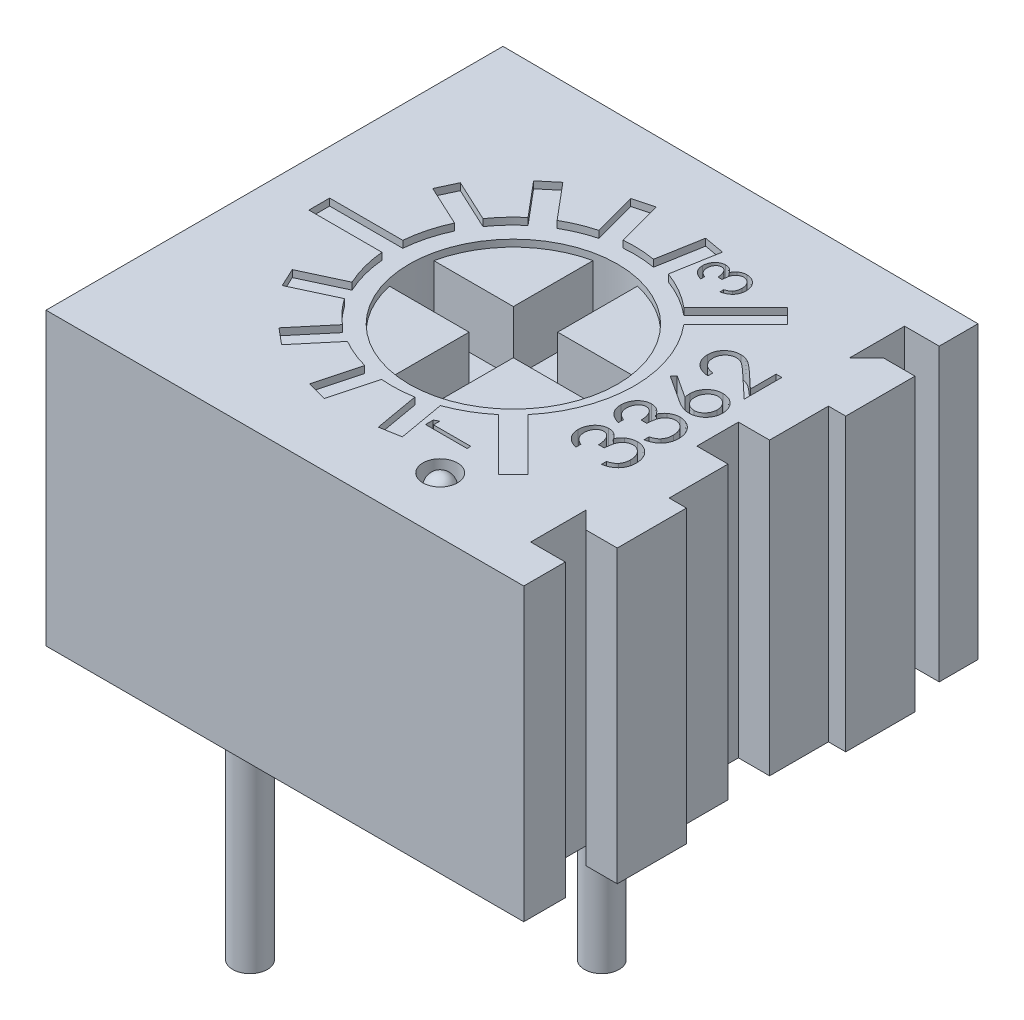
from build123d import *
from build123d.topology import SkipClean

# Parameters (mm, degrees)
BOSS_EXTRUDE1_DEPTH = 4.2
CUT_EXTRUDE3_DEPTH  = 0.2
CUT_EXTRUDE4_DEPTH  = 0.1
CUT_EXTRUDE5_DEPTH  = 0.5
CUT_EXTRUDE6_DEPTH  = 0.3
CUT_EXTRUDE7_DEPTH  = 0.89
SKETCH14_R          = 0.18
BOSS_EXTRUDE2_DEPTH = 0.32
REVOLVE1_ANGLE      = 180
BOSS_EXTRUDE3_DEPTH = 3.24


with BuildPart() as part:
    # Sketch3 → Boss-Extrude1 (new body)
    with BuildSketch(Plane(origin=(0, 0, 0), x_dir=(1, 0, 0), z_dir=(0, 1, 0))):
        Polygon((3.1, -1.938039121), (3.55, -1.938039121), (3.55, -0.938039121), (3.3, -0.938039121), (3.3, -0.088039121), (2.85, -0.088039121), (2.85, 0.511960879), (3.3, 0.511960879), (3.3, 1.361960879), (3.55, 1.361960879), (3.55, 2.361960879), (3.1, 2.361960879), (2.85, 2.111960879), (2.85, 2.911960879), (3.35, 2.911960879), (3.35, 3.472174064), (-3.55, 3.511960879), (-3.55, -3.088039121), (3.35, -3.088039121), (3.35, -2.488039121), (2.85, -2.488039121), (2.85, -1.688039121), align=None)
    extrude(amount=BOSS_EXTRUDE1_DEPTH)

    # Sketch5 → Cut-Extrude3 (cut)
    with BuildSketch(Plane(origin=(0, 4.2, 0), x_dir=(1, 0, 0), z_dir=(0, 1, 0))):
        with BuildLine():
            ThreePointArc((-1.60378018, 0.211962343), (-0.1, -1.291817837), (1.40378018, 0.211962343))
            ThreePointArc((1.40378018, 0.211962343), (-0.1, 1.715742524), (-1.60378018, 0.211962343))
        make_face()
    extrude(amount=-CUT_EXTRUDE3_DEPTH, mode=Mode.SUBTRACT)

    # Sketch5<5> → Cut-Extrude4 (cut)
    with BuildSketch(Plane(origin=(0, 4.2, 0), x_dir=(1, 0, 0), z_dir=(0, 1, 0))):
        with BuildLine():
            Line((-0.435140366, -2.183914718), (-0.260203012, -1.531039623))
            ThreePointArc((-0.260203012, -1.531039623), (-0.029388376, -1.536466305), (0.200131905, -1.511460589))
            Line((0.200131905, -1.511460589), (0.31300322, -2.151585629))
            Line((0.31300322, -2.151585629), (0.608445546, -2.099491175))
            Line((0.608445546, -2.099491175), (0.491075695, -1.433853672))
            ThreePointArc((0.491075695, -1.433853672), (0.770636357, -1.303944211), (1.023064377, -1.126995839))
            Line((1.023064377, -1.126995839), (1.770080564, -1.874012026))
            Line((1.770080564, -1.874012026), (1.982212598, -1.661879991))
            Line((1.982212598, -1.661879991), (1.235196412, -0.914863805))
            ThreePointArc((1.235196412, -0.914863805), (1.540276248, -0.387771779), (1.646247594, 0.211952979))
            ThreePointArc((1.646247594, 0.211952979), (1.540276248, 0.811677736), (1.235196412, 1.338769762))
            Line((1.235196412, 1.338769762), (1.982212598, 2.085785949))
            Line((1.982212598, 2.085785949), (1.770080564, 2.297917983))
            Line((1.770080564, 2.297917983), (1.023064377, 1.550901796))
            ThreePointArc((1.023064377, 1.550901796), (0.770636357, 1.727850169), (0.491075695, 1.857759629))
            Line((0.491075695, 1.857759629), (0.608445546, 2.523397133))
            Line((0.608445546, 2.523397133), (0.31300322, 2.575491586))
            Line((0.31300322, 2.575491586), (0.200131905, 1.935366546))
            ThreePointArc((0.200131905, 1.935366546), (-0.029388376, 1.960372262), (-0.260203012, 1.95494558))
            Line((-0.260203012, 1.95494558), (-0.435140366, 2.607820675))
            Line((-0.435140366, 2.607820675), (-0.724918114, 2.530174962))
            Line((-0.724918114, 2.530174962), (-0.556685735, 1.902323175))
            ThreePointArc((-0.556685735, 1.902323175), (-0.775269625, 1.827986588), (-0.982165312, 1.725521863))
            Line((-0.982165312, 1.725521863), (-1.416629336, 2.243295925))
            Line((-1.416629336, 2.243295925), (-1.646442669, 2.050459642))
            Line((-1.646442669, 2.050459642), (-1.228630723, 1.552530754))
            ThreePointArc((-1.228630723, 1.552530754), (-1.395319005, 1.392781383), (-1.539526714, 1.212478909))
            Line((-1.539526714, 1.212478909), (-2.152105616, 1.498129143))
            Line((-2.152105616, 1.498129143), (-2.278891095, 1.226236807))
            Line((-2.278891095, 1.226236807), (-1.689791033, 0.951534937))
            ThreePointArc((-1.689791033, 0.951534937), (-1.794449828, 0.663663314), (-1.847311983, 0.361952979))
            Line((-1.847311983, 0.361952979), (-2.903752406, 0.361952979))
            Line((-2.903752406, 0.361952979), (-2.903752406, 0.061952979))
            Line((-2.903752406, 0.061952979), (-1.847311983, 0.061952979))
            ThreePointArc((-1.847311983, 0.061952979), (-1.794449828, -0.239757357), (-1.689791033, -0.527628979))
            Line((-1.689791033, -0.527628979), (-2.278891095, -0.80233085))
            Line((-2.278891095, -0.80233085), (-2.152105616, -1.074223186))
            Line((-2.152105616, -1.074223186), (-1.539526714, -0.788572952))
            ThreePointArc((-1.539526714, -0.788572952), (-1.395319005, -0.968875425), (-1.228630723, -1.128624797))
            Line((-1.228630723, -1.128624797), (-1.646442669, -1.626553685))
            Line((-1.646442669, -1.626553685), (-1.416629336, -1.819389968))
            Line((-1.416629336, -1.819389968), (-0.982165312, -1.301615906))
            ThreePointArc((-0.982165312, -1.301615906), (-0.775269625, -1.40408063), (-0.556685735, -1.478417217))
            Line((-0.556685735, -1.478417217), (-0.724918114, -2.106269004))
            Line((-0.724918114, -2.106269004), (-0.435140366, -2.183914718))
        make_face()
    extrude(amount=-CUT_EXTRUDE4_DEPTH, mode=Mode.SUBTRACT)

    # Sketch5<6> → Cut-Extrude5 (cut)
    with BuildSketch(Plane(origin=(0, 4.2, 0), x_dir=(1, 0, 0), z_dir=(0, 1, 0))):
        with BuildLine():
            ThreePointArc((1.081757206, -2.276694537), (1.331757206, -2.526694537), (1.581757206, -2.276694537))
            ThreePointArc((1.581757206, -2.276694537), (1.331757206, -2.026694537), (1.081757206, -2.276694537))
        make_face()
    extrude(amount=-CUT_EXTRUDE5_DEPTH, mode=Mode.SUBTRACT)

    # Sketch10 → Cut-Extrude6 (cut)
    # profile 1 of 6: a face of its own
    with BuildSketch(Plane(origin=(0, 4.2, 0), x_dir=(1, 0, 0), z_dir=(0, 1, 0))):
        Polygon((0.620519629, -1.666924235), (0.620519629, -1.777861735), (1.220519629, -1.777861735), (1.220519629, -1.724015581), (0.682058091, -1.724015581), (0.682058091, -1.631707889), align=None)
    # profile 2 of 6: a face of its own
    with BuildSketch(Plane(origin=(0, 4.2, 0), x_dir=(1, 0, 0), z_dir=(0, 1, 0))):
        with BuildLine():
            Line((0.78751456, 2.085640337), (0.78751456, 2.031794183))
            add(Edge.make_bspline(
                [(0.78751456, 2.031794183), (0.781474706, 2.033252963), (0.769667285, 2.036104759), (0.752797468, 2.042052915), (0.736833436, 2.048532787), (0.722074109, 2.056313776), (0.708222869, 2.064800991), (0.695593876, 2.074524886), (0.683865939, 2.085036839), (0.673457956, 2.096663973), (0.664033202, 2.108857458), (0.655997478, 2.121789107), (0.649084766, 2.135198746), (0.643389869, 2.149179283), (0.639099779, 2.163772341), (0.635987184, 2.178845991), (0.63396585, 2.194439734), (0.633768576, 2.205025035), (0.633668406, 2.210399953)],
                knots=[0, 0, 0, 0, 1.162005537, 2.271625781, 3.343758855, 4.383309926, 5.390229558, 6.379919256, 7.361854164, 8.333198761, 9.295911338, 10.242430842, 11.177959212, 12.116337295, 13.062827104, 14.020064771, 14.994644689, 16, 16, 16, 16], degree=3))
            add(Edge.make_bspline(
                [(0.633668406, 2.210399953), (0.633904846, 2.21823128), (0.634372567, 2.23372311), (0.638643614, 2.25648249), (0.645402208, 2.278429944), (0.654740561, 2.299325244), (0.666258386, 2.318734118), (0.679966627, 2.336003179), (0.695600793, 2.350898352), (0.712869232, 2.363394531), (0.731324462, 2.373178817), (0.750318775, 2.380393623), (0.769807113, 2.384785912), (0.782965504, 2.38535515), (0.78955783, 2.385640337)],
                knots=[0, 0, 0, 0, 1.083050992, 2.142477498, 3.193116406, 4.255571735, 5.30263384, 6.308962982, 7.297363603, 8.282367274, 9.249857812, 10.179914175, 11.08814088, 12, 12, 12, 12], degree=3))
            add(Edge.make_bspline(
                [(0.78955783, 2.385640337), (0.795901851, 2.385440864), (0.808316118, 2.385050527), (0.826439803, 2.381736178), (0.84352122, 2.376158533), (0.859632277, 2.368432288), (0.874670821, 2.358430879), (0.888670688, 2.346315559), (0.901693972, 2.332000817), (0.909154453, 2.321153), (0.91299533, 2.315568222)],
                knots=[0, 0, 0, 0, 1.024540389, 2.004866551, 2.965041327, 3.920577974, 4.882998113, 5.874504559, 6.905732034, 8, 8, 8, 8], degree=3))
            add(Edge.make_bspline(
                [(0.91299533, 2.315568222), (0.916066129, 2.321958944), (0.922160131, 2.334641333), (0.934301296, 2.351753576), (0.947975261, 2.367524746), (0.958765378, 2.376216651), (0.964197253, 2.38059226)],
                knots=[0, 0, 0, 0, 1.015663554, 2.015584519, 3.001021554, 4, 4, 4, 4], degree=3))
            add(Edge.make_bspline(
                [(0.964197253, 2.38059226), (0.96815001, 2.383479347), (0.975990796, 2.389206244), (0.98859704, 2.396275193), (1.00134301, 2.402688184), (1.014570336, 2.407685364), (1.02812571, 2.41155517), (1.042032407, 2.414321347), (1.056301782, 2.416039771), (1.06595535, 2.416285866), (1.07080783, 2.416409568)],
                knots=[0, 0, 0, 0, 1.025084078, 2.033381695, 3.024893161, 4.013698104, 4.991890475, 5.976764909, 6.982997093, 8, 8, 8, 8], degree=3))
            add(Edge.make_bspline(
                [(1.07080783, 2.416409568), (1.079209453, 2.416101893), (1.095973162, 2.41548799), (1.120740901, 2.410002242), (1.144948476, 2.401494523), (1.16811386, 2.389426201), (1.189767372, 2.374651777), (1.209284535, 2.357269018), (1.225797722, 2.337029416), (1.239762082, 2.314666489), (1.250820747, 2.290334097), (1.258791431, 2.264414964), (1.263572241, 2.237059086), (1.264145887, 2.218351768), (1.264437637, 2.208837453)],
                knots=[0, 0, 0, 0, 0.955697303, 1.906897079, 2.875188111, 3.870982192, 4.871999088, 5.854111427, 6.836107184, 7.836239895, 8.848948182, 9.870701427, 10.917064451, 12, 12, 12, 12], degree=3))
            add(Edge.make_bspline(
                [(1.264437637, 2.208837453), (1.264287502, 2.202423119), (1.263992087, 2.18980185), (1.26200853, 2.171240071), (1.25828723, 2.153559531), (1.253607181, 2.136588544), (1.247136489, 2.120583245), (1.239422225, 2.105313411), (1.230266568, 2.090845977), (1.219654119, 2.077266858), (1.20777507, 2.064590563), (1.194432076, 2.053140042), (1.179874164, 2.042788607), (1.163970382, 2.033602029), (1.146765276, 2.025541646), (1.128189901, 2.018780918), (1.108388261, 2.012877967), (1.094592692, 2.010128128), (1.08751456, 2.00871726)],
                knots=[0, 0, 0, 0, 1.048603596, 2.063302207, 3.045874044, 3.999447474, 4.937100059, 5.862643889, 6.7929026, 7.7308982, 8.676022965, 9.627908155, 10.600123445, 11.591992905, 12.626222643, 13.701663232, 14.820785756, 16, 16, 16, 16], degree=3))
            Line((1.08751456, 2.00871726), (1.08751456, 2.062563414))
            add(Edge.make_bspline(
                [(1.08751456, 2.062563414), (1.092134391, 2.063966264), (1.101120363, 2.066694929), (1.114052987, 2.071339666), (1.125908654, 2.07663137), (1.136774332, 2.082308151), (1.146757029, 2.08827017), (1.155592778, 2.0949413), (1.16366967, 2.10182744), (1.168220175, 2.107018186), (1.170447253, 2.109558606)],
                knots=[0, 0, 0, 0, 1.198163088, 2.33053128, 3.407730985, 4.417276592, 5.372219308, 6.28897303, 7.162600585, 8, 8, 8, 8], degree=3))
            add(Edge.make_bspline(
                [(1.170447253, 2.109558606), (1.173036185, 2.112918395), (1.178206058, 2.1196276), (1.184822365, 2.130553666), (1.190485766, 2.142084743), (1.195089216, 2.154316994), (1.198544731, 2.167252058), (1.201031848, 2.180837467), (1.202673732, 2.19509551), (1.202822932, 2.204826345), (1.202899176, 2.209798991)],
                knots=[0, 0, 0, 0, 0.946083416, 1.889246487, 2.84504177, 3.809995578, 4.801312957, 5.829064617, 6.89060985, 8, 8, 8, 8], degree=3))
            add(Edge.make_bspline(
                [(1.202899176, 2.209798991), (1.202793592, 2.215413877), (1.202587132, 2.226393302), (1.200688439, 2.242414135), (1.197923226, 2.257655412), (1.193652429, 2.271947914), (1.188375711, 2.285478858), (1.18175027, 2.298058569), (1.173976889, 2.309852187), (1.165141605, 2.320708657), (1.155469349, 2.330470744), (1.145352822, 2.339066089), (1.13483468, 2.346373174), (1.123856717, 2.352267501), (1.112464392, 2.356921882), (1.100625735, 2.36009043), (1.088437632, 2.362293547), (1.080152666, 2.362472966), (1.075976099, 2.362563414)],
                knots=[0, 0, 0, 0, 1.217147791, 2.380027433, 3.494444702, 4.572153297, 5.609568379, 6.639424714, 7.649109417, 8.668170816, 9.669597737, 10.625200337, 11.543417969, 12.441394052, 13.322311151, 14.205496177, 15.095365482, 16, 16, 16, 16], degree=3))
            add(Edge.make_bspline(
                [(1.075976099, 2.362563414), (1.070385941, 2.362300525), (1.059233442, 2.361776054), (1.042819359, 2.357788566), (1.026998802, 2.351170672), (1.011976674, 2.342087487), (0.99822378, 2.330760067), (0.985865181, 2.317723959), (0.975677157, 2.302624514), (0.968631668, 2.288737625), (0.963825561, 2.276434704), (0.96062408, 2.265906429), (0.957913186, 2.254119559), (0.955391077, 2.241216764), (0.953244561, 2.227100781), (0.951454535, 2.211786993), (0.950022243, 2.195272291), (0.949382626, 2.183839519), (0.949053022, 2.177948029)],
                knots=[0, 0, 0, 0, 1.070505987, 2.135685285, 3.216438728, 4.346150463, 5.486482244, 6.621737109, 7.7759408, 8.963942283, 9.59839197, 10.305095457, 11.070459627, 11.915156775, 12.823989992, 13.805807174, 14.869297358, 16, 16, 16, 16], degree=3))
            Line((0.949053022, 2.177948029), (0.88751456, 2.177948029))
            add(Edge.make_bspline(
                [(0.88751456, 2.177948029), (0.887370437, 2.185368404), (0.887088235, 2.199898012), (0.884359964, 2.221178252), (0.879980016, 2.241440875), (0.873721827, 2.260394602), (0.866350435, 2.277636886), (0.857832996, 2.292656041), (0.848192631, 2.30505668), (0.837613915, 2.314968358), (0.826329779, 2.322501929), (0.814496731, 2.327919856), (0.802067862, 2.331148945), (0.793582549, 2.331578346), (0.789317445, 2.331794183)],
                knots=[0, 0, 0, 0, 1.322091412, 2.58874672, 3.817242262, 5.011895168, 6.140903042, 7.155122731, 8.080855046, 8.929742606, 9.727943956, 10.488587771, 11.240295418, 12, 12, 12, 12], degree=3))
            add(Edge.make_bspline(
                [(0.789317445, 2.331794183), (0.786183596, 2.331724696), (0.779948952, 2.331586455), (0.770811699, 2.329773762), (0.761954172, 2.327175074), (0.753477364, 2.323402093), (0.745363924, 2.318513611), (0.737524849, 2.312617142), (0.73006143, 2.305544634), (0.722935163, 2.297623348), (0.716452233, 2.2888519), (0.710778596, 2.279434897), (0.705965601, 2.269410526), (0.701983565, 2.258842998), (0.698991443, 2.247683069), (0.69684219, 2.235987282), (0.695498662, 2.223732196), (0.695305209, 2.215371336), (0.695206868, 2.211121106)],
                knots=[0, 0, 0, 0, 0.884325644, 1.759323928, 2.622595547, 3.489424008, 4.37295195, 5.294616785, 6.255907374, 7.274251867, 8.302369084, 9.333474657, 10.37669385, 11.44084034, 12.520297356, 13.637342342, 14.798947025, 16, 16, 16, 16], degree=3))
            add(Edge.make_bspline(
                [(0.695206868, 2.211121106), (0.695445387, 2.204289392), (0.695911271, 2.190945464), (0.699991787, 2.171708622), (0.706502316, 2.153825307), (0.714273691, 2.140155821), (0.721945194, 2.130061666), (0.728645031, 2.122848477), (0.736090658, 2.11576496), (0.744740665, 2.10927713), (0.754009258, 2.102715877), (0.764367603, 2.096742524), (0.775545499, 2.090938005), (0.783447608, 2.087440425), (0.78751456, 2.085640337)],
                knots=[0, 0, 0, 0, 1.472543308, 2.876219568, 4.221790263, 5.565193594, 6.249813518, 6.953379497, 7.687249741, 8.463570142, 9.283606569, 10.136032583, 11.040678096, 12, 12, 12, 12], degree=3))
        make_face()
    # profile 3 of 6: a face of its own
    with BuildSketch(Plane(origin=(0, 4.2, 0), x_dir=(1, 0, 0), z_dir=(0, 1, 0))):
        with BuildLine():
            Line((2.0510798, 0.942912174), (2.0510798, 0.871117302))
            add(Edge.make_bspline(
                [(2.0510798, 0.871117302), (2.041555026, 0.871585223), (2.022848622, 0.872504207), (1.995574587, 0.876807816), (1.969504918, 0.88296573), (1.944848938, 0.891672348), (1.921388639, 0.902485212), (1.899217207, 0.915452075), (1.878419221, 0.93081067), (1.859187485, 0.948229352), (1.841544612, 0.967147898), (1.826309128, 0.987560684), (1.813436517, 1.009010976), (1.802675091, 1.031433696), (1.794597412, 1.055081824), (1.788603894, 1.079740763), (1.784997872, 1.105518852), (1.784610264, 1.123082285), (1.784413133, 1.132014738)],
                knots=[0, 0, 0, 0, 1.10065271, 2.161652631, 3.183658789, 4.190468796, 5.17591951, 6.163126047, 7.15150782, 8.156236427, 9.156009102, 10.134482811, 11.092018607, 12.041330605, 13.001268258, 13.972401359, 14.968799086, 16, 16, 16, 16], degree=3))
            add(Edge.make_bspline(
                [(1.784413133, 1.132014738), (1.784616828, 1.140787487), (1.785017082, 1.158025624), (1.788506035, 1.183173923), (1.793852546, 1.207171431), (1.801775232, 1.229746186), (1.811716471, 1.251129866), (1.824079703, 1.271057708), (1.838279943, 1.290011587), (1.855029822, 1.30706128), (1.872901985, 1.322723479), (1.891989305, 1.336223348), (1.911726182, 1.347849541), (1.932266789, 1.357365218), (1.953678017, 1.364578523), (1.975754589, 1.369922891), (1.998751282, 1.372978021), (2.014318943, 1.37344433), (2.022233646, 1.373681405)],
                knots=[0, 0, 0, 0, 1.111674182, 2.184400057, 3.212814286, 4.223731311, 5.211378316, 6.196328225, 7.191884489, 8.207283132, 9.220262353, 10.201199469, 11.166417575, 12.120932471, 13.06540007, 14.026332106, 14.996573967, 16, 16, 16, 16], degree=3))
            add(Edge.make_bspline(
                [(2.022233646, 1.373681405), (2.033376004, 1.373294367), (2.055465186, 1.372527084), (2.087925796, 1.365963887), (2.119375453, 1.355712916), (2.144687699, 1.343371757), (2.165081995, 1.330918465), (2.181881942, 1.319707464), (2.199966207, 1.306508495), (2.219407987, 1.291434323), (2.239952676, 1.274225349), (2.26201944, 1.25532866), (2.285200249, 1.234256244), (2.301043369, 1.219479413), (2.309252877, 1.21182243)],
                knots=[0, 0, 0, 0, 1.184416499, 2.348048165, 3.509039915, 4.696071444, 5.333504901, 6.05069495, 6.844171097, 7.714965912, 8.667477798, 9.695072654, 10.805644396, 12, 12, 12, 12], degree=3))
            Line((2.309252877, 1.21182243), (2.522874672, 1.011662174))
            Line((2.522874672, 1.011662174), (2.522874672, 1.383937815))
            Line((2.522874672, 1.383937815), (2.604925954, 1.383937815))
            Line((2.604925954, 1.383937815), (2.604925954, 0.840348071))
            Line((2.604925954, 0.840348071), (2.27383621, 1.150604482))
            add(Edge.make_bspline(
                [(2.27383621, 1.150604482), (2.265950883, 1.158158284), (2.250804783, 1.172667593), (2.228692107, 1.193189325), (2.208177926, 1.211621094), (2.189301001, 1.228082212), (2.171785214, 1.242215585), (2.156197853, 1.254757809), (2.141853978, 1.264807087), (2.125227552, 1.275713463), (2.104927594, 1.286276659), (2.080119894, 1.295353769), (2.054582236, 1.300888592), (2.037324628, 1.301552554), (2.028643903, 1.301886533)],
                knots=[0, 0, 0, 0, 1.329631726, 2.553950428, 3.673215718, 4.687767853, 5.603093632, 6.413772471, 7.123043292, 7.734684054, 8.834405432, 9.900288307, 10.943827018, 12, 12, 12, 12], degree=3))
            add(Edge.make_bspline(
                [(2.028643903, 1.301886533), (2.023185297, 1.30174122), (2.012427434, 1.301454837), (1.996654689, 1.298927364), (1.981439875, 1.295107819), (1.96673619, 1.289634617), (1.95269147, 1.28241022), (1.939288617, 1.273616304), (1.92633114, 1.263470004), (1.914181814, 1.251732571), (1.903054682, 1.238838509), (1.893197748, 1.225216967), (1.884960237, 1.210805514), (1.878207437, 1.195664915), (1.872910207, 1.179837379), (1.869239675, 1.163292294), (1.866935107, 1.146075376), (1.866623297, 1.134319149), (1.866464415, 1.128328841)],
                knots=[0, 0, 0, 0, 0.991446411, 1.95395049, 2.89581595, 3.838931463, 4.798493298, 5.75982156, 6.748411868, 7.785213223, 8.824556874, 9.840280684, 10.836137867, 11.835679398, 12.848801643, 13.863922112, 14.911575587, 16, 16, 16, 16], degree=3))
            add(Edge.make_bspline(
                [(1.866464415, 1.128328841), (1.866621402, 1.12207108), (1.866929699, 1.109781871), (1.869264891, 1.091776891), (1.872805044, 1.074482322), (1.878427578, 1.058156214), (1.885070882, 1.042445037), (1.893510484, 1.027684199), (1.903317489, 1.013628626), (1.914689111, 1.000509503), (1.927465951, 0.988527568), (1.94154691, 0.977851838), (1.956830617, 0.968585305), (1.973254345, 0.960489049), (1.990981612, 0.953917083), (2.009945464, 0.948894432), (2.030064691, 0.944920356), (2.043958417, 0.943592686), (2.0510798, 0.942912174)],
                knots=[0, 0, 0, 0, 1.030878251, 2.024474673, 2.987898669, 3.934362936, 4.864849709, 5.795128259, 6.730474222, 7.685293701, 8.650606017, 9.611896181, 10.591709709, 11.591680886, 12.625074257, 13.701333388, 14.821793024, 16, 16, 16, 16], degree=3))
        make_face()
    # profile 4 of 6: a face of its own
    with BuildSketch(Plane(origin=(0, 4.2, 0), x_dir=(1, 0, 0), z_dir=(0, 1, 0))):
        with BuildLine():
            Line((1.784413133, 0.594194225), (1.827842621, 0.649482687))
            Line((1.827842621, 0.649482687), (2.1510798, 0.438104482))
            add(Edge.make_bspline(
                [(2.1510798, 0.438104482), (2.148836632, 0.452177688), (2.144461079, 0.479629068), (2.143739263, 0.507415559), (2.143387492, 0.520957046)],
                knots=[0, 0, 0, 0, 1.025318673, 2, 2, 2, 2], degree=3))
            add(Edge.make_bspline(
                [(2.143387492, 0.520957046), (2.143606032, 0.529087902), (2.144036221, 0.545093251), (2.147346816, 0.568591948), (2.152563984, 0.591172277), (2.160169072, 0.612740643), (2.169883891, 0.633374479), (2.181527081, 0.653192124), (2.195699731, 0.671821328), (2.211532017, 0.689500931), (2.229066227, 0.70555532), (2.247676228, 0.719758016), (2.267360549, 0.731753379), (2.288114762, 0.741310151), (2.309776407, 0.748947705), (2.332429966, 0.754384713), (2.356113673, 0.757635039), (2.37222345, 0.758073874), (2.380406723, 0.758296789)],
                knots=[0, 0, 0, 0, 1.043709831, 2.054511743, 3.041122595, 4.01515914, 4.98481438, 5.965901842, 6.960491961, 7.985277438, 9.0096037, 10.00832444, 10.987059228, 11.962929573, 12.936966118, 13.931840027, 14.949438142, 16, 16, 16, 16], degree=3))
            add(Edge.make_bspline(
                [(2.380406723, 0.758296789), (2.391602503, 0.757972299), (2.413633148, 0.757333778), (2.445713267, 0.750944475), (2.476257117, 0.741090232), (2.504736177, 0.726779725), (2.531347695, 0.709341371), (2.554849568, 0.68781427), (2.575809493, 0.663266477), (2.59332912, 0.635495082), (2.6076389, 0.605611786), (2.617916534, 0.574216829), (2.62424422, 0.541616394), (2.625037496, 0.519489619), (2.625438774, 0.508296789)],
                knots=[0, 0, 0, 0, 1.031403119, 2.029557249, 3.004870281, 3.983165322, 4.960181699, 5.929903783, 6.912123683, 7.928973898, 8.949315281, 9.960468141, 10.968302741, 12, 12, 12, 12], degree=3))
            add(Edge.make_bspline(
                [(2.625438774, 0.508296789), (2.625090463, 0.497531376), (2.624400519, 0.476206977), (2.618222358, 0.444846108), (2.608279836, 0.414658773), (2.594295017, 0.386032469), (2.576928799, 0.359470509), (2.556167896, 0.335516962), (2.531983467, 0.314813802), (2.50490456, 0.297429378), (2.475846967, 0.283582688), (2.445495929, 0.273295876), (2.413978866, 0.267255419), (2.392611353, 0.266413269), (2.381849031, 0.265989097)],
                knots=[0, 0, 0, 0, 1.012172929, 2.004937354, 2.995255351, 3.995689452, 4.993936421, 5.973737378, 6.968231049, 7.979117505, 8.993136101, 9.989812463, 10.987515067, 12, 12, 12, 12], degree=3))
            add(Edge.make_bspline(
                [(2.381849031, 0.265989097), (2.373610269, 0.266259142), (2.356788291, 0.266810521), (2.331310799, 0.270660439), (2.305241981, 0.276846678), (2.283126736, 0.283774734), (2.265009817, 0.291094873), (2.250403305, 0.297186882), (2.235372202, 0.30476951), (2.219401086, 0.312854854), (2.202901558, 0.32217071), (2.185597862, 0.332300001), (2.167765193, 0.343522779), (2.155663663, 0.351390244), (2.149477236, 0.355412174)],
                knots=[0, 0, 0, 0, 1.173818275, 2.396712641, 3.66331629, 4.989737886, 5.693666774, 6.447286557, 7.243889047, 8.091586357, 8.998013824, 9.943181721, 10.948533338, 12, 12, 12, 12], degree=3))
            Line((2.149477236, 0.355412174), (1.784413133, 0.594194225))
        make_face()
        with BuildLine():
            add(Edge.make_bspline(
                [(2.225438774, 0.505892943), (2.225614896, 0.499798122), (2.225958913, 0.487893166), (2.228000129, 0.470436919), (2.231715374, 0.453862118), (2.236866886, 0.438163952), (2.243218096, 0.423245579), (2.251367258, 0.409402641), (2.260859171, 0.396350281), (2.271676664, 0.384297042), (2.283512378, 0.37336619), (2.29619153, 0.363953527), (2.3094061, 0.355834078), (2.323267143, 0.349232531), (2.337769193, 0.344091939), (2.352845594, 0.340373483), (2.368597435, 0.338304054), (2.37927915, 0.337959772), (2.384733646, 0.337783969)],
                knots=[0, 0, 0, 0, 1.129656352, 2.206547016, 3.251334079, 4.271920891, 5.265058649, 6.249872215, 7.241923875, 8.251504132, 9.246416584, 10.222533834, 11.173322129, 12.116503788, 13.062124155, 14.020151864, 14.989013135, 16, 16, 16, 16], degree=3))
            add(Edge.make_bspline(
                [(2.384733646, 0.337783969), (2.390138411, 0.337932207), (2.400789164, 0.338224329), (2.416423382, 0.34071145), (2.431434163, 0.344686855), (2.445765093, 0.350429595), (2.45969129, 0.357408168), (2.472778028, 0.366365704), (2.485449215, 0.376646353), (2.497116104, 0.388649949), (2.507947169, 0.401630588), (2.517453451, 0.415469791), (2.525491998, 0.429959184), (2.532152822, 0.445057037), (2.537056139, 0.46094998), (2.540809895, 0.47737995), (2.542862124, 0.494570332), (2.543210071, 0.506208526), (2.543387492, 0.512142943)],
                knots=[0, 0, 0, 0, 0.989367052, 1.949669134, 2.891858276, 3.827522767, 4.772653562, 5.738670152, 6.725809442, 7.756636004, 8.798867547, 9.819240912, 10.826537776, 11.829883227, 12.835515726, 13.868058748, 14.912904531, 16, 16, 16, 16], degree=3))
            add(Edge.make_bspline(
                [(2.543387492, 0.512142943), (2.543210057, 0.51807735), (2.542862083, 0.529715526), (2.54081005, 0.546906046), (2.537055569, 0.563335505), (2.532154887, 0.579230304), (2.525484292, 0.594321273), (2.517503756, 0.608798), (2.507888882, 0.622506314), (2.497134701, 0.635495401), (2.485382548, 0.647449112), (2.472892202, 0.657971551), (2.459586576, 0.666649234), (2.445819851, 0.673904502), (2.431425603, 0.679583656), (2.416425718, 0.683578632), (2.400788555, 0.686060463), (2.390138206, 0.686353311), (2.384733646, 0.686501917)],
                knots=[0, 0, 0, 0, 1.087281468, 2.132306021, 3.165025708, 4.170830268, 5.174347389, 6.181816599, 7.194310624, 8.23672049, 9.267723423, 10.261267456, 11.222032883, 12.171822355, 13.107646935, 14.049997283, 15.01046367, 16, 16, 16, 16], degree=3))
            add(Edge.make_bspline(
                [(2.384733646, 0.686501917), (2.379272035, 0.686376136), (2.368552667, 0.686129269), (2.352852641, 0.683337052), (2.337692591, 0.67946451), (2.32316781, 0.673616957), (2.309335571, 0.666020043), (2.296126168, 0.656766651), (2.283437674, 0.646062227), (2.271653503, 0.633696439), (2.260870898, 0.62023823), (2.251380312, 0.605917246), (2.243279109, 0.590994622), (2.236886618, 0.57526015), (2.231736754, 0.558925537), (2.228013375, 0.541877989), (2.225964234, 0.524105383), (2.225616158, 0.512041081), (2.225438774, 0.505892943)],
                knots=[0, 0, 0, 0, 0.978259475, 1.920005202, 2.851759169, 3.7803069, 4.719124913, 5.675758531, 6.668034766, 7.691045932, 8.733780038, 9.756656648, 10.768121246, 11.773215211, 12.79725739, 13.836288844, 14.897342417, 16, 16, 16, 16], degree=3))
        make_face(mode=Mode.SUBTRACT)
    # profile 5 of 6: a face of its own
    with BuildSketch(Plane(origin=(0, 4.2, 0), x_dir=(1, 0, 0), z_dir=(0, 1, 0))):
        with BuildLine():
            Line((1.989541339, -0.287857057), (1.989541339, -0.359651929))
            add(Edge.make_bspline(
                [(1.989541339, -0.359651929), (1.981488199, -0.357706889), (1.965744971, -0.353904494), (1.943251883, -0.34597362), (1.921966506, -0.33733379), (1.902287404, -0.326959138), (1.883819083, -0.315642851), (1.866980426, -0.302677658), (1.851343177, -0.288661721), (1.837465865, -0.273158876), (1.824899527, -0.256900896), (1.814185229, -0.239658697), (1.804968279, -0.221779178), (1.797375083, -0.203138462), (1.791654964, -0.183681052), (1.787504837, -0.163582852), (1.784809725, -0.142791195), (1.784546693, -0.12867746), (1.784413133, -0.121510903)],
                knots=[0, 0, 0, 0, 1.162005537, 2.271625781, 3.343758855, 4.383309926, 5.390229558, 6.379919256, 7.361854164, 8.333198761, 9.295911338, 10.242430842, 11.177959212, 12.116337295, 13.062827104, 14.020064771, 14.994644689, 16, 16, 16, 16], degree=3))
            add(Edge.make_bspline(
                [(1.784413133, -0.121510903), (1.784728386, -0.111069133), (1.785352015, -0.090413359), (1.791046743, -0.06006752), (1.800058202, -0.030804247), (1.812509339, -0.002943848), (1.82786644, 0.022934651), (1.846144094, 0.045960065), (1.866989648, 0.065820296), (1.890014235, 0.082481868), (1.914621208, 0.095527582), (1.939946958, 0.105147325), (1.965931409, 0.111003709), (1.98347593, 0.111762694), (1.992265697, 0.112142943)],
                knots=[0, 0, 0, 0, 1.083050992, 2.142477498, 3.193116406, 4.255571735, 5.30263384, 6.308962982, 7.297363603, 8.282367274, 9.249857812, 10.179914175, 11.08814088, 12, 12, 12, 12], degree=3))
            add(Edge.make_bspline(
                [(1.992265697, 0.112142943), (2.000724393, 0.111876979), (2.017276749, 0.11135653), (2.041441662, 0.106937397), (2.064216885, 0.099500537), (2.085698294, 0.089198877), (2.105749686, 0.075863666), (2.124416175, 0.059709906), (2.141780554, 0.040623584), (2.151727862, 0.026159826), (2.156849031, 0.018713456)],
                knots=[0, 0, 0, 0, 1.024540389, 2.004866551, 2.965041327, 3.920577974, 4.882998113, 5.874504559, 6.905732034, 8, 8, 8, 8], degree=3))
            add(Edge.make_bspline(
                [(2.156849031, 0.018713456), (2.16094343, 0.027234419), (2.169068767, 0.04414427), (2.185256986, 0.066960596), (2.203488939, 0.087988821), (2.217875763, 0.099578028), (2.225118262, 0.105412174)],
                knots=[0, 0, 0, 0, 1.015663554, 2.015584519, 3.001021554, 4, 4, 4, 4], degree=3))
            add(Edge.make_bspline(
                [(2.225118262, 0.105412174), (2.230388605, 0.109261624), (2.240842986, 0.116897486), (2.257651312, 0.12632275), (2.274645938, 0.134873405), (2.292282373, 0.141536312), (2.310356205, 0.146696053), (2.328898467, 0.150384289), (2.347924301, 0.152675521), (2.360795725, 0.153003648), (2.367265697, 0.153168584)],
                knots=[0, 0, 0, 0, 1.025084078, 2.033381695, 3.024893161, 4.013698104, 4.991890475, 5.976764909, 6.982997093, 8, 8, 8, 8], degree=3))
            add(Edge.make_bspline(
                [(2.367265697, 0.153168584), (2.378467862, 0.152758351), (2.400819474, 0.151939814), (2.433843127, 0.144625484), (2.466119892, 0.133281857), (2.497007072, 0.117190762), (2.525878421, 0.09749153), (2.551901305, 0.074314518), (2.573918888, 0.047328381), (2.592538034, 0.017511145), (2.607282921, -0.014932044), (2.6179105, -0.049490888), (2.624284912, -0.085965392), (2.625049775, -0.110908482), (2.625438774, -0.123594236)],
                knots=[0, 0, 0, 0, 0.955697303, 1.906897079, 2.875188111, 3.870982192, 4.871999088, 5.854111427, 6.836107184, 7.836239895, 8.848948182, 9.870701427, 10.917064451, 12, 12, 12, 12], degree=3))
            add(Edge.make_bspline(
                [(2.625438774, -0.123594236), (2.625238595, -0.132146681), (2.624844708, -0.14897504), (2.622199964, -0.173724078), (2.617238232, -0.197298132), (2.610998166, -0.219926114), (2.602370577, -0.241266513), (2.592084892, -0.261626291), (2.579877348, -0.280916204), (2.565727417, -0.299021696), (2.549888685, -0.315923422), (2.532098026, -0.331190784), (2.512687477, -0.344992698), (2.491482435, -0.357241468), (2.468542293, -0.367988645), (2.443775126, -0.377002949), (2.417372939, -0.38487355), (2.398978848, -0.388540002), (2.389541339, -0.390421159)],
                knots=[0, 0, 0, 0, 1.048603596, 2.063302207, 3.045874044, 3.999447474, 4.937100059, 5.862643889, 6.7929026, 7.7308982, 8.676022965, 9.627908155, 10.600123445, 11.591992905, 12.626222643, 13.701663232, 14.820785756, 16, 16, 16, 16], degree=3))
            Line((2.389541339, -0.390421159), (2.389541339, -0.318626288))
            add(Edge.make_bspline(
                [(2.389541339, -0.318626288), (2.395701113, -0.316755821), (2.407682409, -0.313117601), (2.424925908, -0.306924619), (2.440733463, -0.299869014), (2.455221034, -0.292299972), (2.468531297, -0.284350612), (2.480312296, -0.275455772), (2.491081485, -0.266274254), (2.497148825, -0.259353259), (2.500118262, -0.255966031)],
                knots=[0, 0, 0, 0, 1.198163088, 2.33053128, 3.407730985, 4.417276592, 5.372219308, 6.28897303, 7.162600585, 8, 8, 8, 8], degree=3))
            add(Edge.make_bspline(
                [(2.500118262, -0.255966031), (2.503570171, -0.251486313), (2.510463335, -0.242540706), (2.519285078, -0.227972619), (2.526836279, -0.212597849), (2.532974212, -0.196288181), (2.537581566, -0.179041429), (2.540897722, -0.160927551), (2.543086901, -0.141916827), (2.543285834, -0.12894238), (2.543387492, -0.122312185)],
                knots=[0, 0, 0, 0, 0.946083416, 1.889246487, 2.84504177, 3.809995578, 4.801312957, 5.829064617, 6.89060985, 8, 8, 8, 8], degree=3))
            add(Edge.make_bspline(
                [(2.543387492, -0.122312185), (2.543246714, -0.11482567), (2.542971434, -0.100186437), (2.540439844, -0.078825326), (2.536752892, -0.058503624), (2.531058496, -0.039446955), (2.524022873, -0.021405696), (2.515188952, -0.004632748), (2.504824444, 0.011092077), (2.493044065, 0.025567369), (2.480147723, 0.038583485), (2.466659021, 0.050043946), (2.452634832, 0.059786725), (2.437997547, 0.067645829), (2.42280778, 0.073851669), (2.407022905, 0.078076401), (2.390772101, 0.08101389), (2.37972548, 0.081253115), (2.374156723, 0.081373712)],
                knots=[0, 0, 0, 0, 1.217147791, 2.380027433, 3.494444702, 4.572153297, 5.609568379, 6.639424714, 7.649109417, 8.668170816, 9.669597737, 10.625200337, 11.543417969, 12.441394052, 13.322311151, 14.205496177, 15.095365482, 16, 16, 16, 16], degree=3))
            add(Edge.make_bspline(
                [(2.374156723, 0.081373712), (2.36670318, 0.081023193), (2.35183318, 0.080323899), (2.329947737, 0.075007248), (2.308853661, 0.066183389), (2.288824157, 0.054072476), (2.270486965, 0.038969249), (2.254008833, 0.021587772), (2.240424801, 0.001455179), (2.231030816, -0.017060673), (2.224622673, -0.033464568), (2.220354032, -0.047502268), (2.216739506, -0.063218094), (2.213376693, -0.080421822), (2.210514673, -0.099243131), (2.208127972, -0.119661516), (2.206218248, -0.141681119), (2.205365427, -0.156924814), (2.204925954, -0.164780134)],
                knots=[0, 0, 0, 0, 1.070505987, 2.135685285, 3.216438728, 4.346150463, 5.486482244, 6.621737109, 7.7759408, 8.963942283, 9.59839197, 10.305095457, 11.070459627, 11.915156775, 12.823989992, 13.805807174, 14.869297358, 16, 16, 16, 16], degree=3))
            Line((2.204925954, -0.164780134), (2.122874672, -0.164780134))
            add(Edge.make_bspline(
                [(2.122874672, -0.164780134), (2.122682508, -0.154886301), (2.122306238, -0.13551349), (2.118668543, -0.107139838), (2.112828613, -0.080123006), (2.10448436, -0.05485137), (2.094655839, -0.031861658), (2.083299253, -0.011836119), (2.070445433, 0.004698067), (2.056340478, 0.017913637), (2.041294963, 0.027958399), (2.025517566, 0.035182301), (2.008945741, 0.039487753), (1.99763199, 0.040060289), (1.991945185, 0.040348071)],
                knots=[0, 0, 0, 0, 1.322091412, 2.58874672, 3.817242262, 5.011895168, 6.140903042, 7.155122731, 8.080855046, 8.929742606, 9.727943956, 10.488587771, 11.240295418, 12, 12, 12, 12], degree=3))
            add(Edge.make_bspline(
                [(1.991945185, 0.040348071), (1.987766719, 0.040255422), (1.97945386, 0.0400711), (1.967270856, 0.037654176), (1.955460821, 0.034189259), (1.94415841, 0.029158617), (1.93334049, 0.022640642), (1.92288839, 0.014778683), (1.912937165, 0.005348672), (1.903435476, -0.005213043), (1.894791569, -0.016908307), (1.88722672, -0.02946431), (1.880809392, -0.042830139), (1.875500011, -0.056920175), (1.871510515, -0.071800082), (1.868644844, -0.087394463), (1.866853474, -0.103734578), (1.866595537, -0.114882392), (1.866464415, -0.120549365)],
                knots=[0, 0, 0, 0, 0.884325644, 1.759323928, 2.622595547, 3.489424008, 4.37295195, 5.294616785, 6.255907374, 7.274251867, 8.302369084, 9.333474657, 10.37669385, 11.44084034, 12.520297356, 13.637342342, 14.798947025, 16, 16, 16, 16], degree=3))
            add(Edge.make_bspline(
                [(1.866464415, -0.120549365), (1.866782441, -0.129658317), (1.867403619, -0.14745022), (1.872844308, -0.173099344), (1.881525013, -0.196943764), (1.891886846, -0.215169744), (1.902115516, -0.228628619), (1.911048633, -0.238246204), (1.920976136, -0.247690893), (1.932509479, -0.256341333), (1.944867602, -0.26508967), (1.958678729, -0.273054142), (1.973582591, -0.2807935), (1.984118736, -0.28545694), (1.989541339, -0.287857057)],
                knots=[0, 0, 0, 0, 1.472543308, 2.876219568, 4.221790263, 5.565193594, 6.249813518, 6.953379497, 7.687249741, 8.463570142, 9.283606569, 10.136032583, 11.040678096, 12, 12, 12, 12], degree=3))
        make_face()
    # profile 6 of 6: a face of its own
    with BuildSketch(Plane(origin=(0, 4.2, 0), x_dir=(1, 0, 0), z_dir=(0, 1, 0))):
        with BuildLine():
            Line((1.989541339, -0.903241672), (1.989541339, -0.975036544))
            add(Edge.make_bspline(
                [(1.989541339, -0.975036544), (1.981488199, -0.973091504), (1.965744971, -0.96928911), (1.943251883, -0.961358236), (1.921966506, -0.952718406), (1.902287404, -0.942343753), (1.883819083, -0.931027467), (1.866980426, -0.918062273), (1.851343177, -0.904046337), (1.837465865, -0.888543491), (1.824899527, -0.872285511), (1.814185229, -0.855043312), (1.804968279, -0.837163794), (1.797375083, -0.818523078), (1.791654964, -0.799065667), (1.787504837, -0.778967467), (1.784809725, -0.75817581), (1.784546693, -0.744062075), (1.784413133, -0.736895518)],
                knots=[0, 0, 0, 0, 1.162005537, 2.271625781, 3.343758855, 4.383309926, 5.390229558, 6.379919256, 7.361854164, 8.333198761, 9.295911338, 10.242430842, 11.177959212, 12.116337295, 13.062827104, 14.020064771, 14.994644689, 16, 16, 16, 16], degree=3))
            add(Edge.make_bspline(
                [(1.784413133, -0.736895518), (1.784728386, -0.726453749), (1.785352015, -0.705797975), (1.791046743, -0.675452136), (1.800058202, -0.646188863), (1.812509339, -0.618328463), (1.82786644, -0.592449964), (1.846144094, -0.56942455), (1.866989648, -0.549564319), (1.890014235, -0.532902747), (1.914621208, -0.519857033), (1.939946958, -0.51023729), (1.965931409, -0.504380906), (1.98347593, -0.503621922), (1.992265697, -0.503241672)],
                knots=[0, 0, 0, 0, 1.083050992, 2.142477498, 3.193116406, 4.255571735, 5.30263384, 6.308962982, 7.297363603, 8.282367274, 9.249857812, 10.179914175, 11.08814088, 12, 12, 12, 12], degree=3))
            add(Edge.make_bspline(
                [(1.992265697, -0.503241672), (2.000724393, -0.503507636), (2.017276749, -0.504028086), (2.041441662, -0.508447218), (2.064216885, -0.515884078), (2.085698294, -0.526185738), (2.105749686, -0.53952095), (2.124416175, -0.555674709), (2.141780554, -0.574761032), (2.151727862, -0.589224789), (2.156849031, -0.596671159)],
                knots=[0, 0, 0, 0, 1.024540389, 2.004866551, 2.965041327, 3.920577974, 4.882998113, 5.874504559, 6.905732034, 8, 8, 8, 8], degree=3))
            add(Edge.make_bspline(
                [(2.156849031, -0.596671159), (2.16094343, -0.588150197), (2.169068767, -0.571240345), (2.185256986, -0.54842402), (2.203488939, -0.527395794), (2.217875763, -0.515806587), (2.225118262, -0.509972442)],
                knots=[0, 0, 0, 0, 1.015663554, 2.015584519, 3.001021554, 4, 4, 4, 4], degree=3))
            add(Edge.make_bspline(
                [(2.225118262, -0.509972442), (2.230388605, -0.506122992), (2.240842986, -0.49848713), (2.257651312, -0.489061865), (2.274645938, -0.48051121), (2.292282373, -0.473848303), (2.310356205, -0.468688562), (2.328898467, -0.465000326), (2.347924301, -0.462709094), (2.360795725, -0.462380968), (2.367265697, -0.462216031)],
                knots=[0, 0, 0, 0, 1.025084078, 2.033381695, 3.024893161, 4.013698104, 4.991890475, 5.976764909, 6.982997093, 8, 8, 8, 8], degree=3))
            add(Edge.make_bspline(
                [(2.367265697, -0.462216031), (2.378467862, -0.462626265), (2.400819474, -0.463444802), (2.433843127, -0.470759132), (2.466119892, -0.482102758), (2.497007072, -0.498193853), (2.525878421, -0.517893085), (2.551901305, -0.541070097), (2.573918888, -0.568056234), (2.592538034, -0.59787347), (2.607282921, -0.630316659), (2.6179105, -0.664875504), (2.624284912, -0.701350007), (2.625049775, -0.726293097), (2.625438774, -0.738978852)],
                knots=[0, 0, 0, 0, 0.955697303, 1.906897079, 2.875188111, 3.870982192, 4.871999088, 5.854111427, 6.836107184, 7.836239895, 8.848948182, 9.870701427, 10.917064451, 12, 12, 12, 12], degree=3))
            add(Edge.make_bspline(
                [(2.625438774, -0.738978852), (2.625238595, -0.747531296), (2.624844708, -0.764359655), (2.622199964, -0.789108694), (2.617238232, -0.812682747), (2.610998166, -0.835310729), (2.602370577, -0.856651128), (2.592084892, -0.877010906), (2.579877348, -0.89630082), (2.565727417, -0.914406311), (2.549888685, -0.931308038), (2.532098026, -0.946575399), (2.512687477, -0.960377313), (2.491482435, -0.972626083), (2.468542293, -0.98337326), (2.443775126, -0.992387564), (2.417372939, -1.000258165), (2.398978848, -1.003924618), (2.389541339, -1.005805775)],
                knots=[0, 0, 0, 0, 1.048603596, 2.063302207, 3.045874044, 3.999447474, 4.937100059, 5.862643889, 6.7929026, 7.7308982, 8.676022965, 9.627908155, 10.600123445, 11.591992905, 12.626222643, 13.701663232, 14.820785756, 16, 16, 16, 16], degree=3))
            Line((2.389541339, -1.005805775), (2.389541339, -0.934010903))
            add(Edge.make_bspline(
                [(2.389541339, -0.934010903), (2.395701113, -0.932140436), (2.407682409, -0.928502216), (2.424925908, -0.922309234), (2.440733463, -0.915253629), (2.455221034, -0.907684587), (2.468531297, -0.899735228), (2.480312296, -0.890840388), (2.491081485, -0.881658869), (2.497148825, -0.874737874), (2.500118262, -0.871350647)],
                knots=[0, 0, 0, 0, 1.198163088, 2.33053128, 3.407730985, 4.417276592, 5.372219308, 6.28897303, 7.162600585, 8, 8, 8, 8], degree=3))
            add(Edge.make_bspline(
                [(2.500118262, -0.871350647), (2.503570171, -0.866870929), (2.510463335, -0.857925321), (2.519285078, -0.843357234), (2.526836279, -0.827982464), (2.532974212, -0.811672797), (2.537581566, -0.794426044), (2.540897722, -0.776312166), (2.543086901, -0.757301442), (2.543285834, -0.744326995), (2.543387492, -0.7376968)],
                knots=[0, 0, 0, 0, 0.946083416, 1.889246487, 2.84504177, 3.809995578, 4.801312957, 5.829064617, 6.89060985, 8, 8, 8, 8], degree=3))
            add(Edge.make_bspline(
                [(2.543387492, -0.7376968), (2.543246714, -0.730210286), (2.542971434, -0.715571052), (2.540439844, -0.694209941), (2.536752892, -0.673888239), (2.531058496, -0.65483157), (2.524022873, -0.636790311), (2.515188952, -0.620017363), (2.504824444, -0.604292539), (2.493044065, -0.589817246), (2.480147723, -0.57680113), (2.466659021, -0.56534067), (2.452634832, -0.55559789), (2.437997547, -0.547738786), (2.42280778, -0.541532946), (2.407022905, -0.537308215), (2.390772101, -0.534370726), (2.37972548, -0.5341315), (2.374156723, -0.534010903)],
                knots=[0, 0, 0, 0, 1.217147791, 2.380027433, 3.494444702, 4.572153297, 5.609568379, 6.639424714, 7.649109417, 8.668170816, 9.669597737, 10.625200337, 11.543417969, 12.441394052, 13.322311151, 14.205496177, 15.095365482, 16, 16, 16, 16], degree=3))
            add(Edge.make_bspline(
                [(2.374156723, -0.534010903), (2.36670318, -0.534361422), (2.35183318, -0.535060717), (2.329947737, -0.540377367), (2.308853661, -0.549201226), (2.288824157, -0.561312139), (2.270486965, -0.576415366), (2.254008833, -0.593796843), (2.240424801, -0.613929436), (2.231030816, -0.632445288), (2.224622673, -0.648849183), (2.220354032, -0.662886884), (2.216739506, -0.67860271), (2.213376693, -0.695806437), (2.210514673, -0.714627747), (2.208127972, -0.735046132), (2.206218248, -0.757065734), (2.205365427, -0.772309429), (2.204925954, -0.780164749)],
                knots=[0, 0, 0, 0, 1.070505987, 2.135685285, 3.216438728, 4.346150463, 5.486482244, 6.621737109, 7.7759408, 8.963942283, 9.59839197, 10.305095457, 11.070459627, 11.915156775, 12.823989992, 13.805807174, 14.869297358, 16, 16, 16, 16], degree=3))
            Line((2.204925954, -0.780164749), (2.122874672, -0.780164749))
            add(Edge.make_bspline(
                [(2.122874672, -0.780164749), (2.122682508, -0.770270917), (2.122306238, -0.750898106), (2.118668543, -0.722524453), (2.112828613, -0.695507622), (2.10448436, -0.670235986), (2.094655839, -0.647246273), (2.083299253, -0.627220734), (2.070445433, -0.610686548), (2.056340478, -0.597470978), (2.041294963, -0.587426216), (2.025517566, -0.580202314), (2.008945741, -0.575896862), (1.99763199, -0.575324327), (1.991945185, -0.575036544)],
                knots=[0, 0, 0, 0, 1.322091412, 2.58874672, 3.817242262, 5.011895168, 6.140903042, 7.155122731, 8.080855046, 8.929742606, 9.727943956, 10.488587771, 11.240295418, 12, 12, 12, 12], degree=3))
            add(Edge.make_bspline(
                [(1.991945185, -0.575036544), (1.987766719, -0.575129194), (1.97945386, -0.575313515), (1.967270856, -0.577730439), (1.955460821, -0.581195356), (1.94415841, -0.586225998), (1.93334049, -0.592743973), (1.92288839, -0.600605932), (1.912937165, -0.610035944), (1.903435476, -0.620597658), (1.894791569, -0.632292922), (1.88722672, -0.644848925), (1.880809392, -0.658214754), (1.875500011, -0.672304791), (1.871510515, -0.687184697), (1.868644844, -0.702779079), (1.866853474, -0.719119193), (1.866595537, -0.730267008), (1.866464415, -0.73593398)],
                knots=[0, 0, 0, 0, 0.884325644, 1.759323928, 2.622595547, 3.489424008, 4.37295195, 5.294616785, 6.255907374, 7.274251867, 8.302369084, 9.333474657, 10.37669385, 11.44084034, 12.520297356, 13.637342342, 14.798947025, 16, 16, 16, 16], degree=3))
            add(Edge.make_bspline(
                [(1.866464415, -0.73593398), (1.866782441, -0.745042933), (1.867403619, -0.762834836), (1.872844308, -0.78848396), (1.881525013, -0.812328379), (1.891886846, -0.83055436), (1.902115516, -0.844013234), (1.911048633, -0.85363082), (1.920976136, -0.863075508), (1.932509479, -0.871725948), (1.944867602, -0.880474286), (1.958678729, -0.888438757), (1.973582591, -0.896178115), (1.984118736, -0.900841555), (1.989541339, -0.903241672)],
                knots=[0, 0, 0, 0, 1.472543308, 2.876219568, 4.221790263, 5.565193594, 6.249813518, 6.953379497, 7.687249741, 8.463570142, 9.283606569, 10.136032583, 11.040678096, 12, 12, 12, 12], degree=3))
        make_face()
    extrude(amount=-CUT_EXTRUDE6_DEPTH, mode=Mode.SUBTRACT)

    # Sketch11 → Cut-Extrude7 (cut)
    with SkipClean():  # the faces are left unmerged after this step: merging them gives an invalid solid
        with BuildSketch(Plane(origin=(0, 4, 0), x_dir=(1, 0, 0), z_dir=(0, 1, 0))):
            with BuildLine():
                Line((-0.42, 0.531962343), (-0.42, 1.681300572))
                ThreePointArc((-0.42, 1.681300572), (-0.1, 1.715742524), (0.22, 1.681300572))
                Line((0.22, 1.681300572), (0.22, 0.531962343))
                Line((0.22, 0.531962343), (1.369338229, 0.531962343))
                ThreePointArc((1.369338229, 0.531962343), (1.40378018, 0.211962343), (1.369338229, -0.108037657))
                Line((1.369338229, -0.108037657), (0.22, -0.108037657))
                Line((0.22, -0.108037657), (0.22, -1.257375885))
                ThreePointArc((0.22, -1.257375885), (-0.1, -1.291817837), (-0.42, -1.257375885))
                Line((-0.42, -1.257375885), (-0.42, -0.108037657))
                Line((-0.42, -0.108037657), (-1.569338229, -0.108037657))
                ThreePointArc((-1.569338229, -0.108037657), (-1.60378018, 0.211962343), (-1.569338229, 0.531962343))
                Line((-1.569338229, 0.531962343), (-0.42, 0.531962343))
            make_face()
        extrude(amount=-CUT_EXTRUDE7_DEPTH, mode=Mode.SUBTRACT)



with BuildPart() as body_2:
    # Sketch14 → Boss-Extrude2 (new body)
    with BuildSketch(Plane(origin=(0, 3.7, 0), x_dir=(1, 0, 0), z_dir=(0, 1, 0))):
        with Locations(Location((1.331757206, -2.276694537, 0), (0, 0, 270))):
            Circle(SKETCH14_R)
    extrude(amount=BOSS_EXTRUDE2_DEPTH)


with BuildPart() as part_1:
    with SkipClean():  # the faces are left unmerged after this step: merging them gives an invalid solid
        add(part.part)

        add(body_2.part)  # Revolve1 merges body 2
        # Sketch15 → Revolve1 (revolve)
        with BuildSketch(Plane(origin=(0, 4.02, 0), x_dir=(1, 0, 0), z_dir=(0, 1, 0))):
            with BuildLine():
                Line((1.222052953, -2.419400448), (1.441461458, -2.133988626))
                ThreePointArc((1.441461458, -2.133988626), (1.474463117, -2.38639879), (1.222052953, -2.419400448))
            make_face()
        revolve(axis=Axis((1.222052953, 4.02, 2.419400448), (-0.6094680694070695, 0, 0.7928106157041664)), revolution_arc=REVOLVE1_ANGLE)

    # Sketch17 → Boss-Extrude3 (add)
    with SkipClean():  # the faces are left unmerged after this step: merging them gives an invalid solid
        with BuildSketch(Plane.XZ):
            with BuildLine():
                ThreePointArc((-1.644341327, -2.782983926), (-1.394341327, -3.032983926), (-1.144341327, -2.782983926))
                ThreePointArc((-1.144341327, -2.782983926), (-1.394341327, -2.532983926), (-1.644341327, -2.782983926))
            make_face()
            with BuildLine():
                ThreePointArc((0.895658673, -0.242983926), (1.145658673, -0.492983926), (1.395658673, -0.242983926))
                ThreePointArc((1.395658673, -0.242983926), (1.145658673, 0.007016074), (0.895658673, -0.242983926))
            make_face()
            with BuildLine():
                ThreePointArc((-1.644341327, 2.297016074), (-1.394341327, 2.047016074), (-1.144341327, 2.297016074))
                ThreePointArc((-1.144341327, 2.297016074), (-1.394341327, 2.547016074), (-1.644341327, 2.297016074))
            make_face()
        extrude(amount=BOSS_EXTRUDE3_DEPTH)


solid = part_1.part
